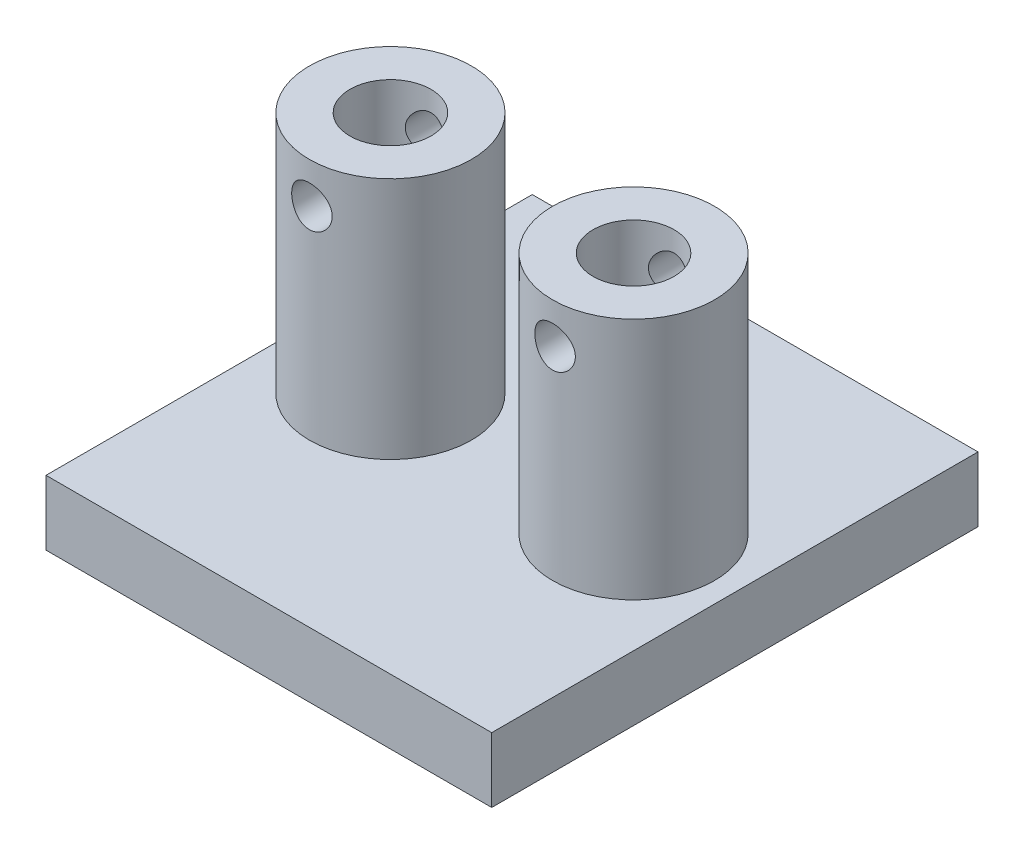
from build123d import *

# Parameters (mm, degrees)
SKETCH1_W               = 11
SKETCH1_H               = 12
BOSS_EXTRUDE1_DEPTH     = 1.6
SKETCH2_R               = 2
SKETCH2_R_2             = 1
BOSS_EXTRUDE2_DEPTH     = 6
CUT_EXTRUDE1_DEPTH      = 2
CUT_EXTRUDE1_DEPTH_BACK = 2
SKETCH3_R               = 0.5


with BuildPart() as part:
    # Sketch1 → Boss-Extrude1 (new body)
    with BuildSketch(Plane(origin=(0, 0, 0), x_dir=(1, 0, 0), z_dir=(0, 1, 0))):
        Rectangle(SKETCH1_W, SKETCH1_H)
    extrude(amount=BOSS_EXTRUDE1_DEPTH)

    # Sketch2 → Boss-Extrude2 (add)
    # profile 1 of 2: a face of its own
    with BuildSketch(Plane(origin=(0, 1.6, 0), x_dir=(1, 0, 0), z_dir=(0, 1, 0))):
        with Locations(Location((-3, 0, 0), (0, 0, 270))):
            Circle(SKETCH2_R)
        with Locations(Location((-3, 0, 0), (0, 0, 270))):
            Circle(SKETCH2_R_2, mode=Mode.SUBTRACT)
    # profile 2 of 2: a face of its own
    with BuildSketch(Plane(origin=(0, 1.6, 0), x_dir=(1, 0, 0), z_dir=(0, 1, 0))):
        with Locations(Location((3, 0, 0), (0, 0, 270))):
            Circle(SKETCH2_R)
        with Locations(Location((3, 0, 0), (0, 0, 270))):
            Circle(SKETCH2_R_2, mode=Mode.SUBTRACT)
    extrude(amount=BOSS_EXTRUDE2_DEPTH)

    # Sketch3 → Cut-Extrude1 (cut, two sides: drawn at the far end of the back side and taken through both)
    with BuildSketch(Plane.XY.offset(-CUT_EXTRUDE1_DEPTH_BACK)):
        with Locations(Location((-3, 6.6, 0), (0, 0, 270.000000002))):
            Circle(SKETCH3_R)
        with Locations(Location((3, 6.6, 0), (0, 0, 270.000000002))):
            Circle(SKETCH3_R)
    extrude(amount=CUT_EXTRUDE1_DEPTH + CUT_EXTRUDE1_DEPTH_BACK, mode=Mode.SUBTRACT)


solid = part.part
